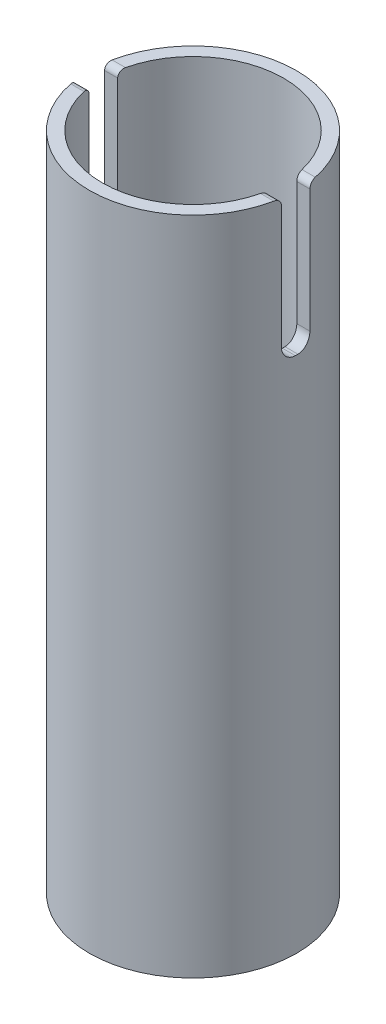
from build123d import *

# Parameters (mm, degrees)
SKETCH_1_R               = 8
EXTRUDE_1_DEPTH          = 51
SKETCH_2_R               = 7
CUT_EXTRUDE_1_DEPTH      = 38
CUT_EXTRUDE_2_DEPTH      = 53.239831546
CUT_EXTRUDE_2_DEPTH_BACK = 53.239831546
SKETCH_3_W               = 2.2
SKETCH_3_H               = 22
FILLET_1_R               = 0.5
FILLET_2_R               = 1
SKETCH_4_R               = 3
CUT_EXTRUDE_3_DEPTH      = 53.239831675
SKETCH_5_R               = 1.5
CUT_EXTRUDE_8_DEPTH      = 38


with BuildPart() as part:
    # 草图1 → 凸台-拉伸1 (new body)
    with BuildSketch(Plane(origin=(0, 0, 0), x_dir=(1, 0, 0), z_dir=(0, 1, 0))):
        with Locations(Location((0, 0, 0), (0, 0, 270))):
            Circle(SKETCH_1_R)
    extrude(amount=EXTRUDE_1_DEPTH)

    # 草图2 → 切除-拉伸1 (cut)
    with BuildSketch(Plane(origin=(0, 51, 0), x_dir=(1, 0, 0), z_dir=(0, 1, 0))):
        with Locations(Location((0, 0, 0), (0, 0, 270))):
            Circle(SKETCH_2_R)
    extrude(amount=-CUT_EXTRUDE_1_DEPTH, mode=Mode.SUBTRACT)

    # 草图3 → 切除-拉伸2 (cut, two sides: drawn at the far end of the back side and taken through both)
    with BuildSketch(Plane(origin=(0, 0, 0), x_dir=(0, 0, -1), z_dir=(1, 0, 0)).offset(-CUT_EXTRUDE_2_DEPTH_BACK)):
        with Locations((0, 51)):
            Rectangle(SKETCH_3_W, SKETCH_3_H)
    extrude(amount=CUT_EXTRUDE_2_DEPTH + CUT_EXTRUDE_2_DEPTH_BACK, mode=Mode.SUBTRACT)

    # 圆角1
    fillet_1_edges = [part.edges().sort_by_distance(p)[0] for p in [
        (7.418522654, 51, -1.1),
        (-7.418522654, 51, -1.1),
        (-7.418522654, 51, 1.1),
        (7.418522654, 51, 1.1),
    ]]
    fillet(fillet_1_edges, radius=FILLET_1_R)

    # 圆角2
    fillet_2_edges = [part.edges().sort_by_distance(p)[0] for p in [
        (7.418522654, 40, -1.1),
        (-7.418522654, 40, -1.1),
        (7.418522654, 40, 1.1),
        (-7.418522654, 40, 1.1),
    ]]
    fillet(fillet_2_edges, radius=FILLET_2_R)

    # 草图4 → 切除-拉伸3 (cut, through all)
    with BuildSketch(Plane(origin=(0, 0, 0), x_dir=(-1, 0, 0), z_dir=(0, -1, 0))):
        with Locations(Location((0, 0, 0), (0, 0, 90))):
            Circle(SKETCH_4_R)
    extrude(amount=-CUT_EXTRUDE_3_DEPTH, mode=Mode.SUBTRACT)

    # 草图5 → 切除-拉伸8 (cut)
    with BuildSketch(Plane.XZ):
        with Locations(Location((0, 5.5, 0), (0, 0, 270))):
            Circle(SKETCH_5_R)
    extrude(amount=-CUT_EXTRUDE_8_DEPTH, mode=Mode.SUBTRACT)


solid = part.part
